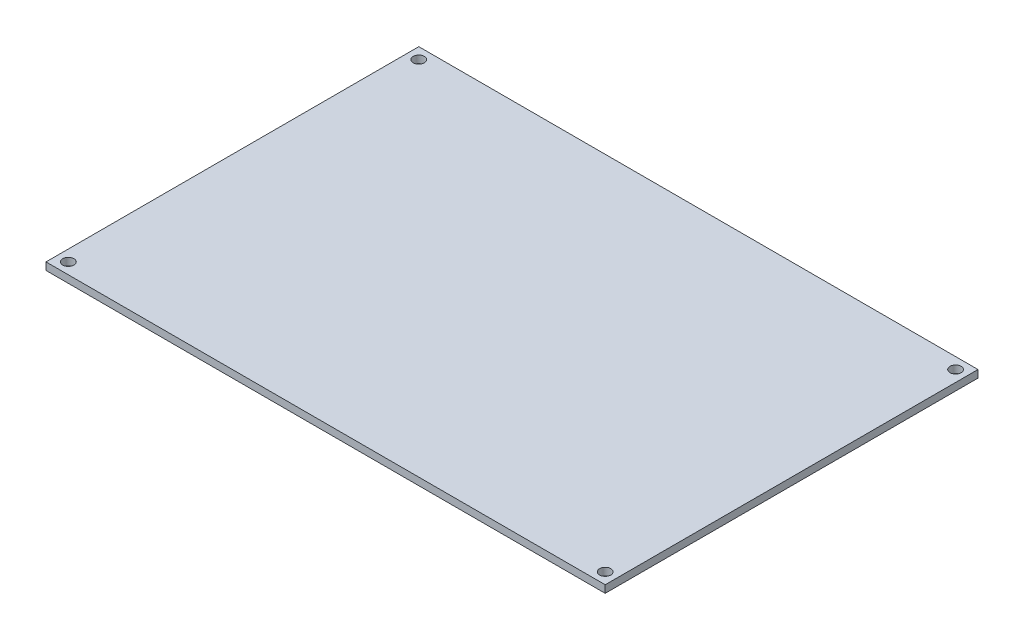
from build123d import *

# Parameters (mm, degrees)
SKETCH1_W           = 150
SKETCH1_H           = 100
BOSS_EXTRUDE1_DEPTH = 2
SKETCH2_R           = 1.5
CUT_EXTRUDE1_DEPTH  = 91.160967164


with BuildPart() as part:
    # Sketch1 → Boss-Extrude1 (new body)
    with BuildSketch(Plane(origin=(0, 0, 0), x_dir=(1, 0, 0), z_dir=(0, 1, 0))):
        Rectangle(SKETCH1_W, SKETCH1_H)
    extrude(amount=BOSS_EXTRUDE1_DEPTH)

    # Sketch2 → Cut-Extrude1 (cut, through all)
    with BuildSketch(Plane(origin=(0, 2, 0), x_dir=(1, 0, 0), z_dir=(0, 1, 0))):
        with Locations(Location((-72, 47, 0), (0, 0, 270))):
            Circle(SKETCH2_R)
        with Locations(Location((-72, -47, 0), (0, 0, 270))):
            Circle(SKETCH2_R)
        with Locations(Location((72, -47, 0), (0, 0, 270))):
            Circle(SKETCH2_R)
        with Locations(Location((72, 47, 0), (0, 0, 270))):
            Circle(SKETCH2_R)
    extrude(amount=-CUT_EXTRUDE1_DEPTH, mode=Mode.SUBTRACT)


solid = part.part
